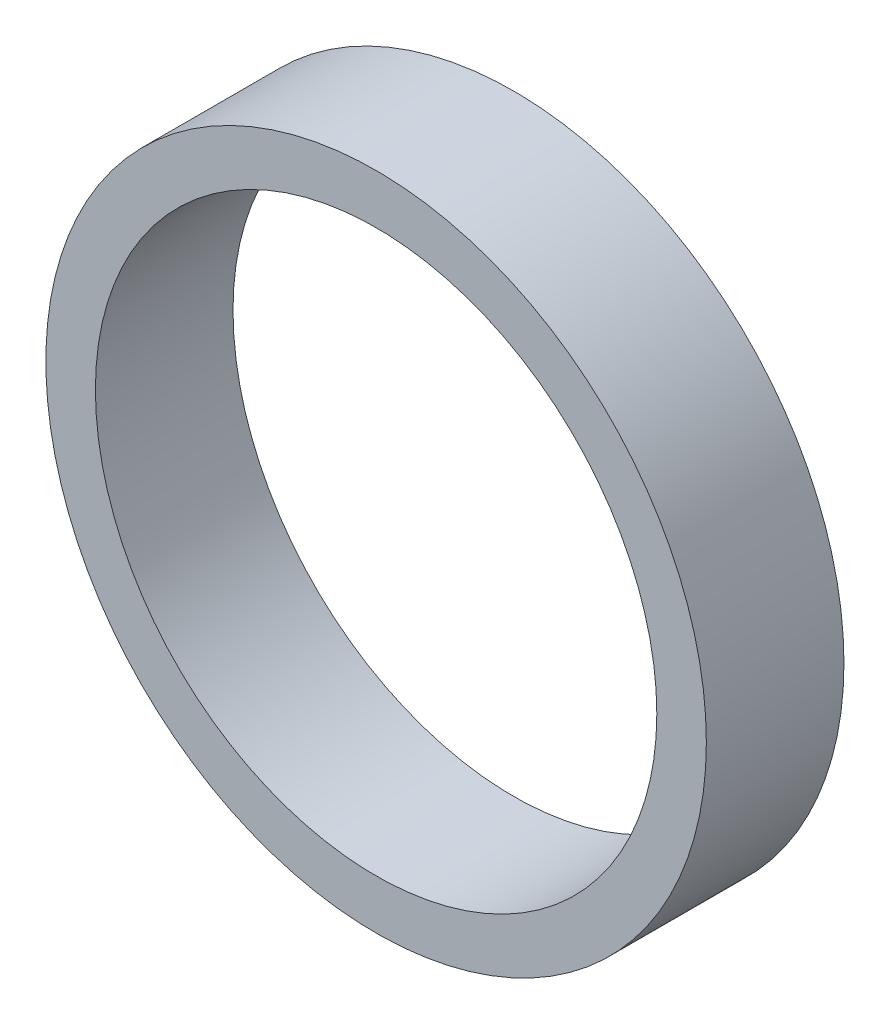
from build123d import *

# Parameters (mm, degrees)
SKETCH1_R           = 6
SKETCH1_R_2         = 5.1
BOSS_EXTRUDE1_DEPTH = 2.5


with BuildPart() as part:
    # Sketch1 → Boss-Extrude1 (new body)
    with BuildSketch(Plane.XY):
        Circle(SKETCH1_R)
        Circle(SKETCH1_R_2, mode=Mode.SUBTRACT)
    extrude(amount=BOSS_EXTRUDE1_DEPTH)


solid = part.part
